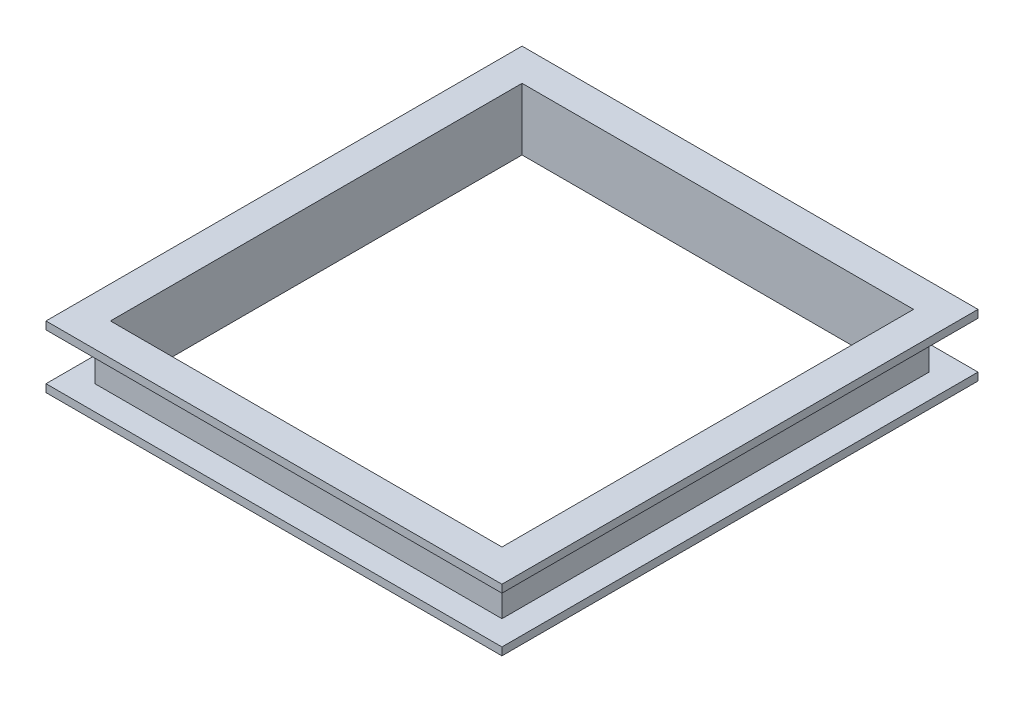
from build123d import *

# Parameters (mm, degrees)
SKETCH1_W               = 50.45
SKETCH1_H               = 53.04
BOSS_EXTRUDE1_DEPTH     = 8
CUT_EXTRUDE1_DEPTH      = 6
CUT_EXTRUDE2_DEPTH      = 6
CUT_EXTRUDE3_DEPTH      = 6
CUT_EXTRUDE4_DEPTH      = 6
CUT_EXTRUDE5_DEPTH      = 21
CUT_EXTRUDE5_DEPTH_BACK = 19
SKETCH6_W               = 64.45
SKETCH6_H               = 67.04


with BuildPart() as part:
    # Sketch1 → Boss-Extrude1 (new body)
    with BuildSketch(Plane(origin=(0, 0, 0), x_dir=(1, 0, 0), z_dir=(0, 1, 0))):
        Polygon((50.45, 60.04), (57.45, 60.04), (57.45, 53.04), (57.45, 0), (57.45, -7), (50.45, -7), (0, -7), (-7, -7), (-7, 53.04), (-7, 60.04), (0, 60.04), align=None)
        with Locations((25.225, 26.52)):
            Rectangle(SKETCH1_W, SKETCH1_H, mode=Mode.SUBTRACT)
    extrude(amount=BOSS_EXTRUDE1_DEPTH)

    # Sketch2 → Cut-Extrude1 (cut)
    with BuildSketch(Plane.XY.offset(7)):
        Polygon((-7, 7), (72.572595869, 7), (72.572595869, 1), (-15.083079444, 1), (-15.083079444, 7), align=None)
    extrude(amount=-CUT_EXTRUDE1_DEPTH, mode=Mode.SUBTRACT)

    # Sketch3 → Cut-Extrude2 (cut)
    with BuildSketch(Plane.ZY.offset(7)):
        Polygon((1, 7), (-62.487898414, 7), (-62.487898414, 1), (1, 1), (11.114700275, 1), (11.114700275, 7), align=None)
    extrude(amount=-CUT_EXTRUDE2_DEPTH, mode=Mode.SUBTRACT)

    # Sketch4 → Cut-Extrude3 (cut)
    with BuildSketch(Plane(origin=(0, 0, -60.04), x_dir=(-1, 0, 0), z_dir=(0, 0, -1))):
        Polygon((1, 7), (-63.689958153, 7), (-63.689958153, 1), (1, 1), (11.838030302, 1), (11.838030302, 7), align=None)
    extrude(amount=-CUT_EXTRUDE3_DEPTH, mode=Mode.SUBTRACT)

    # Sketch5 → Cut-Extrude4 (cut)
    with BuildSketch(Plane(origin=(57.45, 0, 0), x_dir=(0, 0, -1), z_dir=(1, 0, 0))):
        Polygon((-1, 7), (54.04, 7), (62.072343262, 7), (62.072343262, 1), (-1, 1), (-8.754047033, 1), (-8.754047033, 7), align=None)
    extrude(amount=-CUT_EXTRUDE4_DEPTH, mode=Mode.SUBTRACT)

    # Sketch6 → Cut-Extrude5 (cut, two sides: drawn at the far end of the back side and taken through both)
    with BuildSketch(Plane(origin=(0, 8, 0), x_dir=(1, 0, 0), z_dir=(0, 1, 0)).offset(-CUT_EXTRUDE5_DEPTH_BACK)):
        with Locations((25.225, 26.52)):
            Rectangle(SKETCH6_W, SKETCH6_H)
        Polygon((-4.150556557, 26.52), (-4.150556557, 57.19), (54.6, 57.19), (54.6, -4.15), (-4.150556557, -4.15), align=None, mode=Mode.SUBTRACT)
    extrude(amount=CUT_EXTRUDE5_DEPTH + CUT_EXTRUDE5_DEPTH_BACK, mode=Mode.SUBTRACT)


solid = part.part
